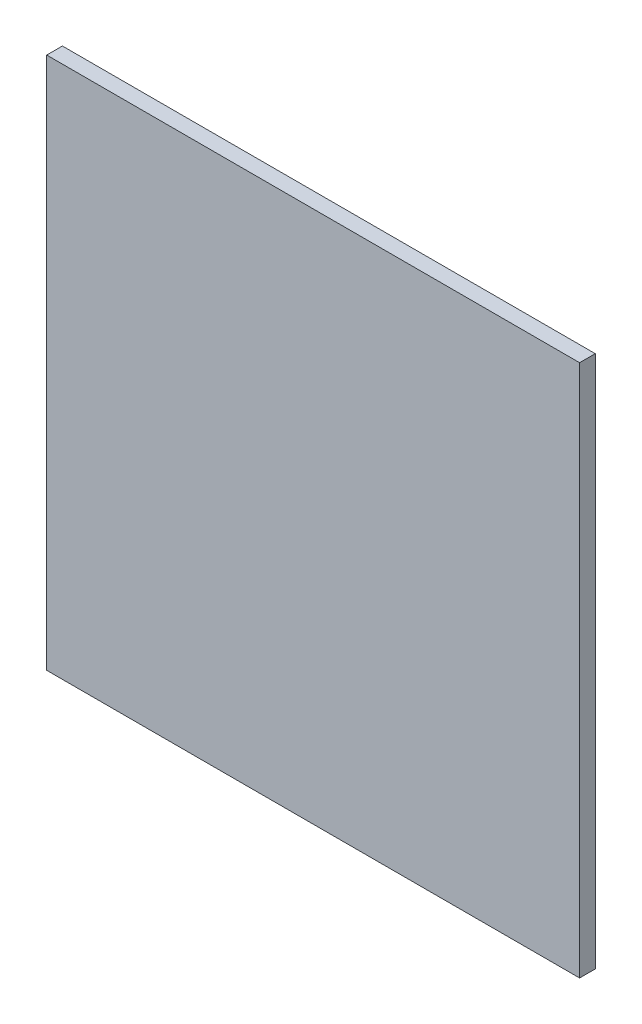
from build123d import *

# Parameters (mm, degrees)
SKETCH_1_W      = 102
SKETCH_1_H      = 102
EXTRUDE_1_DEPTH = 3


with BuildPart() as part:
    # 草图1 → 凸台-拉伸1 (new body)
    with BuildSketch(Plane.XY):
        Rectangle(SKETCH_1_W, SKETCH_1_H)
    extrude(amount=EXTRUDE_1_DEPTH)


solid = part.part
